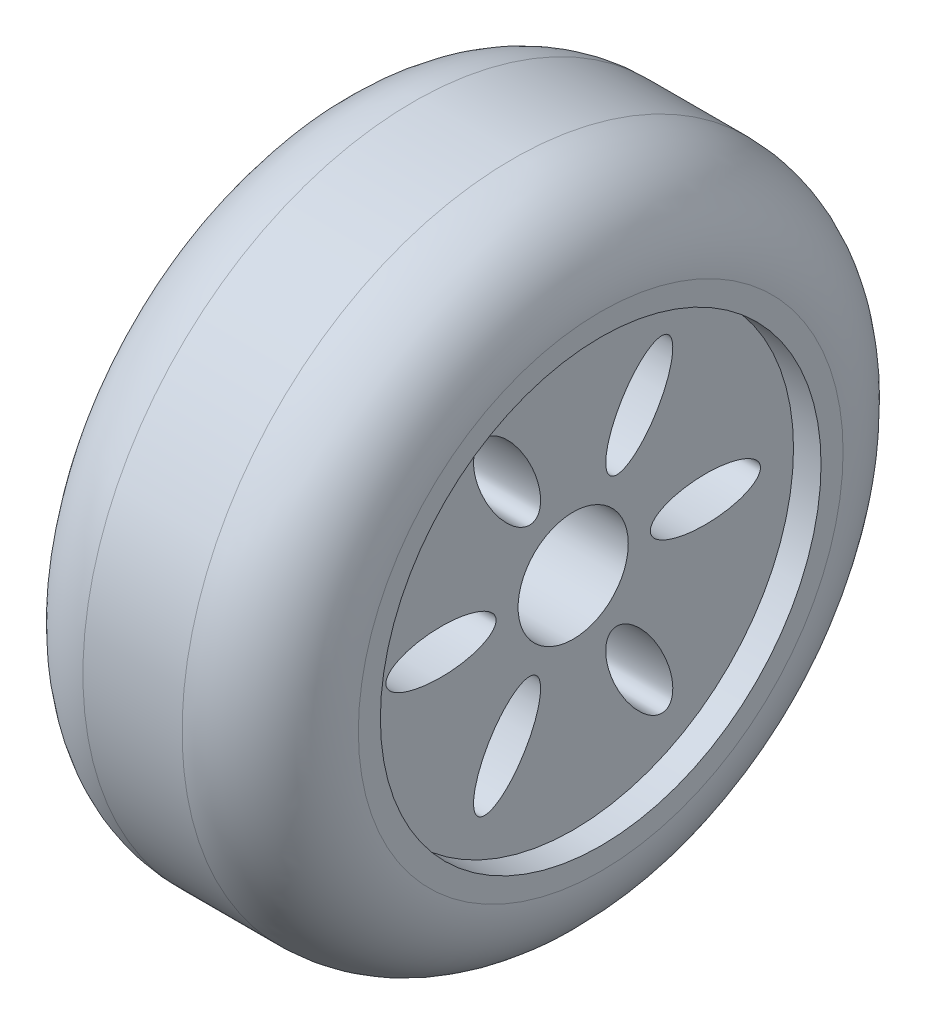
from build123d import *

# Parameters (mm, degrees)
SKETCH1_R           = 30
SKETCH1_R_2         = 20
BOSS_EXTRUDE1_DEPTH = 12.5
FILLET1_R           = 8
SKETCH2_R           = 20
SKETCH2_R_2         = 5
SKETCH2_RX          = 5
SKETCH2_RY          = 2
BOSS_EXTRUDE3_DEPTH = 10


with BuildPart() as part:
    # Sketch1 → Boss-Extrude1 (new, symmetric)
    with BuildSketch(Plane(origin=(0, 0, 0), x_dir=(0, 0, -1), z_dir=(1, 0, 0))):
        Circle(SKETCH1_R)
        Circle(SKETCH1_R_2, mode=Mode.SUBTRACT)
    extrude(amount=BOSS_EXTRUDE1_DEPTH, both=True)

    # Fillet1
    fillet1_edges = [part.edges().sort_by_distance(p)[0] for p in [
        (-12.5, 0, 30),
        (12.5, 0, 30),
    ]]
    fillet(fillet1_edges, radius=FILLET1_R)


with BuildPart() as body_2:
    # Sketch2 → Boss-Extrude3 (new, symmetric)
    with BuildSketch(Plane(origin=(0, 0, 0), x_dir=(0, 0, -1), z_dir=(1, 0, 0))):
        Circle(SKETCH2_R)
        Circle(SKETCH2_R_2, mode=Mode.SUBTRACT)
        with Locations(Location((-12, 0), (0, 0, 180))):
            Ellipse(SKETCH2_RX, SKETCH2_RY, mode=Mode.SUBTRACT)
        with Locations(Location((-6, 10.392304845), (0, 0, 120))):
            Ellipse(SKETCH2_RX, SKETCH2_RY, mode=Mode.SUBTRACT)
        with Locations(Location((6, 10.392304845), (0, 0, 60))):
            Ellipse(SKETCH2_RX, SKETCH2_RY, mode=Mode.SUBTRACT)
        with Locations(Location((12, 0), (0, 0, 0))):
            Ellipse(SKETCH2_RX, SKETCH2_RY, mode=Mode.SUBTRACT)
        with Locations(Location((6, -10.392304845), (0, 0, -60))):
            Ellipse(SKETCH2_RX, SKETCH2_RY, mode=Mode.SUBTRACT)
        with Locations(Location((-6, -10.392304845), (0, 0, -120))):
            Ellipse(SKETCH2_RX, SKETCH2_RY, mode=Mode.SUBTRACT)
    extrude(amount=BOSS_EXTRUDE3_DEPTH, both=True)


solid = Compound([part.part, body_2.part])
